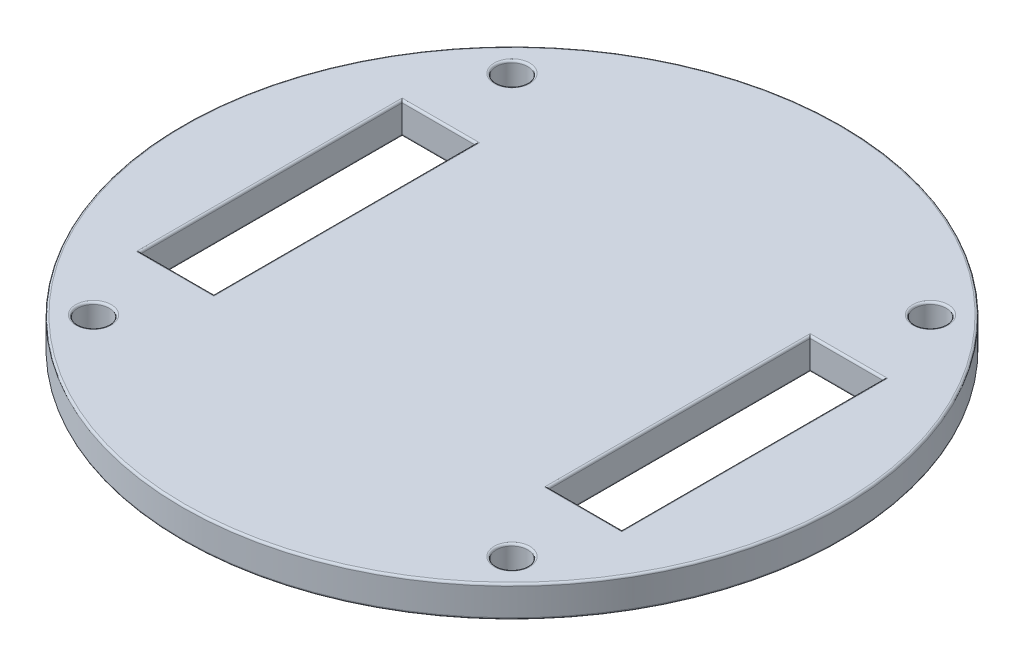
from build123d import *

# Parameters (mm, degrees)
SKETCH1_R           = 31.5
BOSS_EXTRUDE1_DEPTH = 3
CUT_EXTRUDE1_REACH  = 46.649
SKETCH2_W           = 7
SKETCH2_H           = 25
CUT_EXTRUDE2_REACH  = 46.649
SKETCH3_R           = 1.5
FILLET1_R           = 0.2


with BuildPart() as part:
    # Sketch1 → Boss-Extrude1 (new body)
    with BuildSketch(Plane(origin=(0, 0, 0), x_dir=(1, 0, 0), z_dir=(0, 1, 0))):
        with Locations(Location((0, 0, 0), (0, 0, 270))):
            Circle(SKETCH1_R)
    extrude(amount=BOSS_EXTRUDE1_DEPTH)

    # Sketch2 → Cut-Extrude1 (cut, up to next)
    with BuildSketch(Plane(origin=(0, 3, 0), x_dir=(1, 0, 0), z_dir=(0, 1, 0)), mode=Mode.PRIVATE) as cut_extrude1_sk1:
        with Locations((-19.5, 0)):
            Rectangle(SKETCH2_W, SKETCH2_H)
    cut_extrude1_tool1 = extrude(cut_extrude1_sk1.sketch, amount=-CUT_EXTRUDE1_REACH, mode=Mode.PRIVATE) & part.part
    # Sketch2 → Cut-Extrude1 (cut, up to next)
    with BuildSketch(Plane(origin=(0, 3, 0), x_dir=(1, 0, 0), z_dir=(0, 1, 0)), mode=Mode.PRIVATE) as cut_extrude1_sk2:
        with Locations((19.5, 0)):
            Rectangle(SKETCH2_W, SKETCH2_H)
    cut_extrude1_tool2 = extrude(cut_extrude1_sk2.sketch, amount=-CUT_EXTRUDE1_REACH, mode=Mode.PRIVATE) & part.part
    add(cut_extrude1_tool1.solids().sort_by_distance((-19.5, 3, 0))[0], mode=Mode.SUBTRACT)
    add(cut_extrude1_tool2.solids().sort_by_distance((19.5, 3, 0))[0], mode=Mode.SUBTRACT)

    # Sketch3 → Cut-Extrude2 (cut, up to next)
    with BuildSketch(Plane(origin=(0, 3, 0), x_dir=(1, 0, 0), z_dir=(0, 1, 0)), mode=Mode.PRIVATE) as cut_extrude2_sk1:
        with Locations(Location((-20, -20, 0), (0, 0, 270))):
            Circle(SKETCH3_R)
    cut_extrude2_tool1 = extrude(cut_extrude2_sk1.sketch, amount=-CUT_EXTRUDE2_REACH, mode=Mode.PRIVATE) & part.part
    # Sketch3 → Cut-Extrude2 (cut, up to next)
    with BuildSketch(Plane(origin=(0, 3, 0), x_dir=(1, 0, 0), z_dir=(0, 1, 0)), mode=Mode.PRIVATE) as cut_extrude2_sk2:
        with Locations(Location((20, -20, 0), (0, 0, 270))):
            Circle(SKETCH3_R)
    cut_extrude2_tool2 = extrude(cut_extrude2_sk2.sketch, amount=-CUT_EXTRUDE2_REACH, mode=Mode.PRIVATE) & part.part
    # Sketch3 → Cut-Extrude2 (cut, up to next)
    with BuildSketch(Plane(origin=(0, 3, 0), x_dir=(1, 0, 0), z_dir=(0, 1, 0)), mode=Mode.PRIVATE) as cut_extrude2_sk3:
        with Locations(Location((20, 20, 0), (0, 0, 270))):
            Circle(SKETCH3_R)
    cut_extrude2_tool3 = extrude(cut_extrude2_sk3.sketch, amount=-CUT_EXTRUDE2_REACH, mode=Mode.PRIVATE) & part.part
    # Sketch3 → Cut-Extrude2 (cut, up to next)
    with BuildSketch(Plane(origin=(0, 3, 0), x_dir=(1, 0, 0), z_dir=(0, 1, 0)), mode=Mode.PRIVATE) as cut_extrude2_sk4:
        with Locations(Location((-20, 20, 0), (0, 0, 270))):
            Circle(SKETCH3_R)
    cut_extrude2_tool4 = extrude(cut_extrude2_sk4.sketch, amount=-CUT_EXTRUDE2_REACH, mode=Mode.PRIVATE) & part.part
    add(cut_extrude2_tool1.solids().sort_by_distance((-20, 3, 20))[0], mode=Mode.SUBTRACT)
    add(cut_extrude2_tool2.solids().sort_by_distance((20, 3, 20))[0], mode=Mode.SUBTRACT)
    add(cut_extrude2_tool3.solids().sort_by_distance((20, 3, -20))[0], mode=Mode.SUBTRACT)
    add(cut_extrude2_tool4.solids().sort_by_distance((-20, 3, -20))[0], mode=Mode.SUBTRACT)

    # Fillet1
    fillet1_edges = [part.edges().sort_by_distance(p)[0] for p in [
        (-23, 3, 0),
        (-19.5, 3, 12.5),
        (-16, 3, 0),
        (-19.5, 3, -12.5),
        (-19.5, 0, 12.5),
        (-23, 0, 0),
        (-19.5, 0, -12.5),
        (-16, 0, 0),
        (0, 0, -31.5),
        (23, 3, 0),
        (19.5, 3, -12.5),
        (16, 3, 0),
        (19.5, 3, 12.5),
        (19.5, 0, -12.5),
        (23, 0, 0),
        (19.5, 0, 12.5),
        (16, 0, 0),
        (-20, 3, -21.5),
        (-20, 0, -21.5),
        (20, 3, -21.5),
        (20, 0, -21.5),
        (20, 3, 18.5),
        (20, 0, 18.5),
        (-20, 3, 18.5),
        (-20, 0, 18.5),
        (0, 3, -31.5),
    ]]
    fillet(fillet1_edges, radius=FILLET1_R)


solid = part.part
